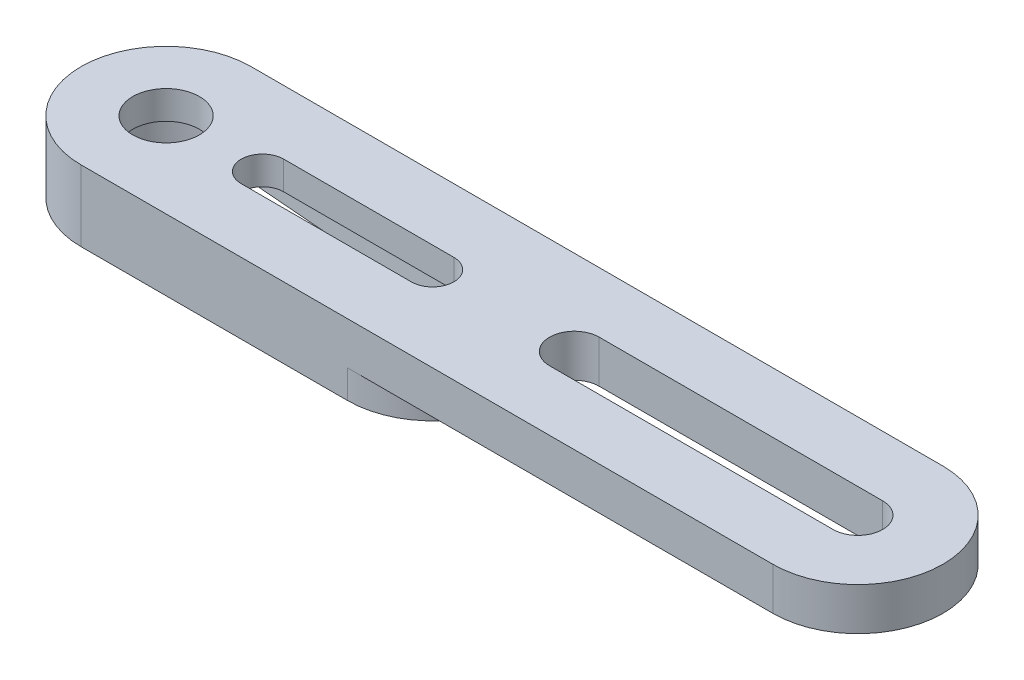
from build123d import *

# Parameters (mm, degrees)
EXTRUDE_1_DEPTH     = 3
EXTRUDE_START       = 2
SKETCH_1_4_R        = 2.35
EXTRUDE_2_DEPTH     = 2
EXTRUDE_3_DEPTH     = 3
CUT_EXTRUDE_1_DEPTH = 10


with BuildPart() as part:
    # 草图1 → 凸台-拉伸1 (new body)
    with BuildSketch(Plane(origin=(0, 0, 0), x_dir=(1, 0, 0), z_dir=(0, 1, 0))):
        with BuildLine():
            ThreePointArc((0, 6), (-6, 0), (0, -6))
            Line((0, -6), (18.8, -6))
            ThreePointArc((18.8, -6), (24.8, 0), (18.8, 6))
            Line((18.8, 6), (0, 6))
        make_face()
        with BuildLine():
            ThreePointArc((0.32712766, -4.086928858), (-4.1, 0), (0.32712766, 4.086928858))
            Line((0.32712766, 4.086928858), (19.007446809, 2.591710983))
            ThreePointArc((19.007446809, 2.591710983), (21.4, 0), (19.007446809, -2.591710983))
            Line((19.007446809, -2.591710983), (0.32712766, -4.086928858))
        make_face(mode=Mode.SUBTRACT)
    extrude(amount=-EXTRUDE_1_DEPTH)

    # 草图1<4> → 凸台-拉伸2 (add)
    with BuildSketch(Plane(origin=(0, 0, 0), x_dir=(1, 0, 0), z_dir=(0, 1, 0)).offset(EXTRUDE_START)):
        with BuildLine():
            ThreePointArc((0, 6), (-6, 0), (0, -6))
            Line((0, -6), (18.8, -6))
            ThreePointArc((18.8, -6), (24.8, 0), (18.8, 6))
            Line((18.8, 6), (0, 6))
        make_face()
        Circle(SKETCH_1_4_R, mode=Mode.SUBTRACT)
    extrude(amount=-EXTRUDE_2_DEPTH)

    # 草图2 → 凸台-拉伸3 (add)
    with BuildSketch(Plane(origin=(0, 2, 0), x_dir=(1, 0, 0), z_dir=(0, 1, 0))):
        with BuildLine():
            Line((48.8, 6), (18.8, 6))
            ThreePointArc((18.8, 6), (24.8, 0), (18.8, -6))
            Line((18.8, -6), (48.8, -6))
            ThreePointArc((48.8, -6), (54.8, 0), (48.8, 6))
        make_face()
        with BuildLine():
            ThreePointArc((48.8, 1.75), (50.55, 0), (48.8, -1.75))
            Line((48.8, -1.75), (28.8, -1.75))
            ThreePointArc((28.8, -1.75), (27.05, 0), (28.8, 1.75))
            Line((28.8, 1.75), (48.8, 1.75))
        make_face(mode=Mode.SUBTRACT)
    extrude(amount=-EXTRUDE_3_DEPTH)

    # 草图2<3> → 切除-拉伸1 (cut)
    with BuildSketch(Plane(origin=(0, 2, 0), x_dir=(1, 0, 0), z_dir=(0, 1, 0))):
        with BuildLine():
            ThreePointArc((18.8, -1.5), (20.3, 0), (18.8, 1.5))
            Line((18.8, 1.5), (6.8, 1.5))
            ThreePointArc((6.8, 1.5), (5.3, 0), (6.8, -1.5))
            Line((6.8, -1.5), (18.8, -1.5))
        make_face()
    extrude(amount=-CUT_EXTRUDE_1_DEPTH, mode=Mode.SUBTRACT)


solid = part.part
